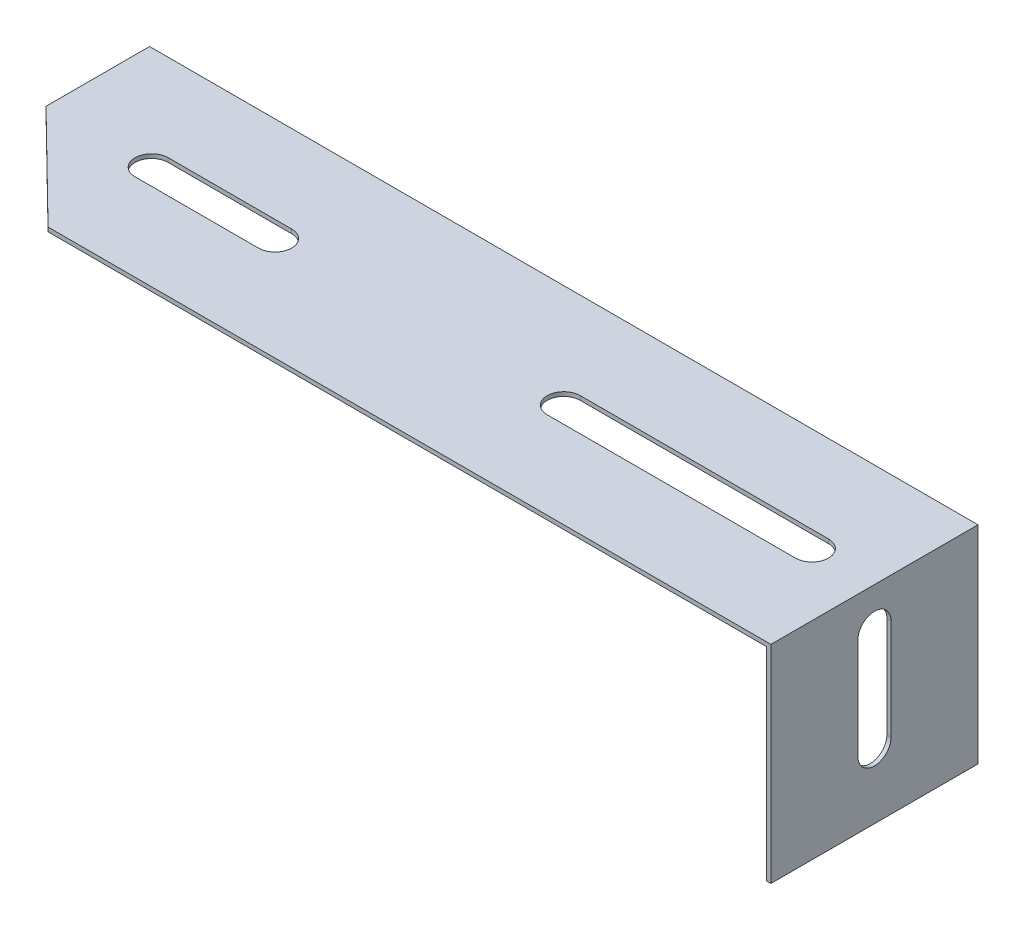
from build123d import *

# Parameters (mm, degrees)
BOSS_EXTRUDE1_DEPTH = 1
SKETCH2_W           = 50
SKETCH2_H           = 50
BOSS_EXTRUDE2_DEPTH = 1
CUT_EXTRUDE1_DEPTH  = 1


with BuildPart() as part:
    # Sketch1 → Boss-Extrude1 (new body)
    with BuildSketch(Plane(origin=(0, 0, 0), x_dir=(1, 0, 0), z_dir=(0, 1, 0))):
        Polygon((-200, 25), (-174.5, 0), (0, 0), (0, 50), (-200, 50), align=None)
        with BuildLine():
            ThreePointArc((-174.5, 21), (-178.5, 25), (-174.5, 29))
            Line((-174.5, 29), (-144.7, 29))
            ThreePointArc((-144.7, 29), (-140.7, 25), (-144.7, 21))
            Line((-144.7, 21), (-174.5, 21))
        make_face(mode=Mode.SUBTRACT)
        with BuildLine():
            ThreePointArc((-75, 21), (-79, 25), (-75, 29))
            Line((-75, 29), (-15.08, 29))
            ThreePointArc((-15.08, 29), (-11.08, 25), (-15.08, 21))
            Line((-15.08, 21), (-75, 21))
        make_face(mode=Mode.SUBTRACT)
    extrude(amount=BOSS_EXTRUDE1_DEPTH)

    # Sketch2 → Boss-Extrude2 (add)
    with BuildSketch(Plane(origin=(0, 0, 0), x_dir=(0, 0, -1), z_dir=(1, 0, 0))):
        with Locations((25, -24)):
            Rectangle(SKETCH2_W, SKETCH2_H)
    extrude(amount=-BOSS_EXTRUDE2_DEPTH)

    # Sketch3 → Cut-Extrude1 (cut)
    with BuildSketch(Plane(origin=(0, 0, 0), x_dir=(0, 0, -1), z_dir=(1, 0, 0))):
        with BuildLine():
            Line((29, -8.58942274), (29, -32.915209985))
            ThreePointArc((29, -32.915209985), (25, -36.915209985), (21, -32.915209985))
            Line((21, -32.915209985), (21, -8.58942274))
            ThreePointArc((21, -8.58942274), (25, -4.58942274), (29, -8.58942274))
        make_face()
    extrude(amount=-CUT_EXTRUDE1_DEPTH, mode=Mode.SUBTRACT)


solid = part.part
